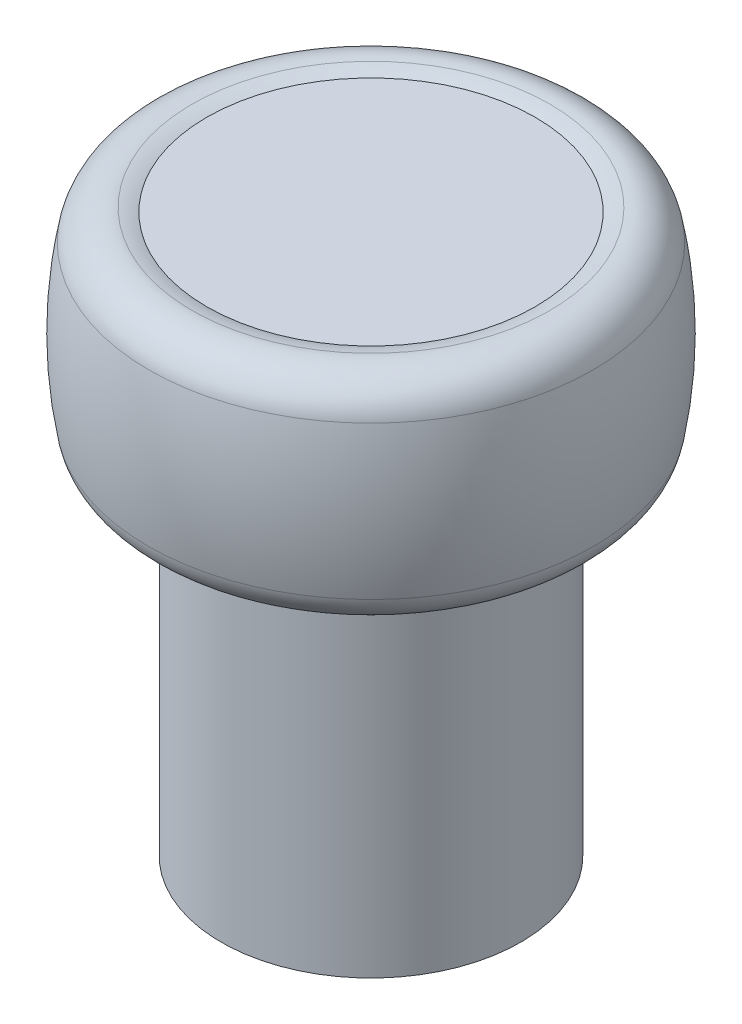
from build123d import *

# Parameters (mm, degrees)
ZAOBLIT1_R = 2.7


with BuildPart() as part:
    # Skica1 → Rotovat1 (revolve)
    with BuildSketch(Plane.XY, mode=Mode.PRIVATE) as rotovat1_sk:
        with BuildLine():
            Line((0, 0), (0, 40))
            Line((0, 40), (-11.78, 40))
            ThreePointArc((-11.78, 40), (-13.640287208, 40.357347759), (-15.5, 39.997022564))
            ThreePointArc((-15.5, 39.997022564), (-16.452624903, 32.497022564), (-15.5, 24.997022564))
            Line((-15.5, 24.997022564), (-10.75, 24.997022564))
            Line((-10.75, 24.997022564), (-10.75, 0))
            Line((-10.75, 0), (0, 0))
        make_face()
    revolve(rotovat1_sk.sketch.rotate(Axis((0, 0, 0), (0, 1, 0)), 270), axis=Axis((0, 0, 0), (0, 1, 0)))

    # Zaoblit1
    zaoblit1_edges = [part.edges().sort_by_distance(p)[0] for p in [
        (0, 39.997022564, 15.5),
        (0, 24.997022564, 15.5),
    ]]
    fillet(zaoblit1_edges, radius=ZAOBLIT1_R)


solid = part.part
